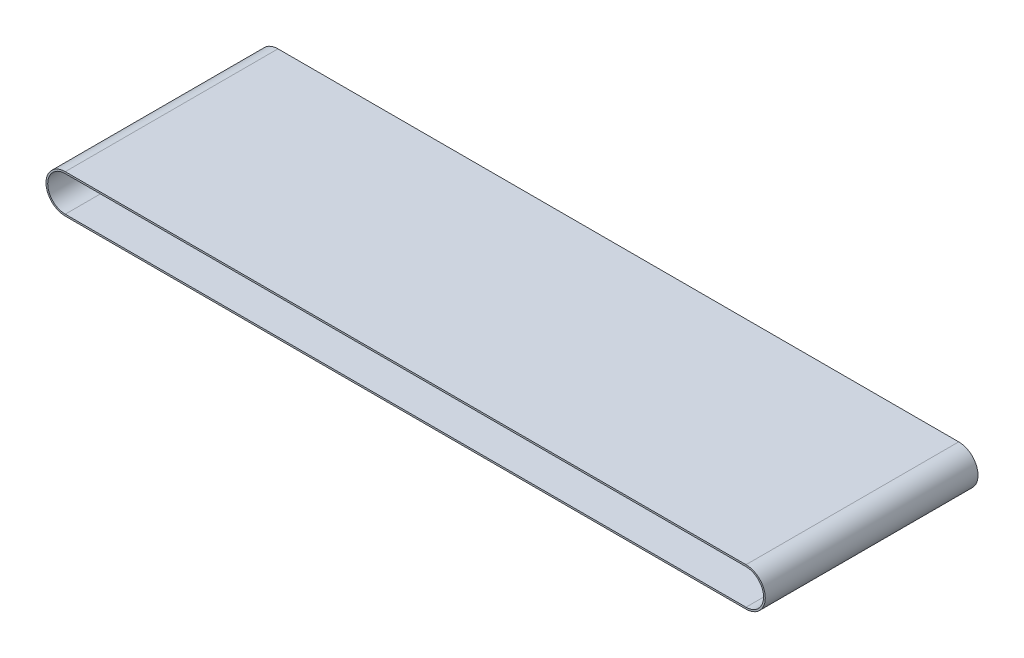
from build123d import *

# Parameters (mm, degrees)
BOSS_EXTRUDE1_DEPTH = 250


with BuildPart() as part:
    # Sketch1 → Boss-Extrude1 (new body)
    with BuildSketch(Plane.XY):
        with BuildLine():
            Line((0, 22.639636035), (800, 22.639636035))
            ThreePointArc((800, 22.639636035), (822.639636035, 0), (800, -22.639636035))
            Line((800, -22.639636035), (0, -22.639636035))
            ThreePointArc((0, -22.639636035), (-22.639636035, 0), (0, 22.639636035))
        make_face()
        with BuildLine():
            Line((0, 20.639636035), (800, 20.639636035))
            ThreePointArc((800, 20.639636035), (820.639636035, 0), (800, -20.639636035))
            Line((800, -20.639636035), (0, -20.639636035))
            ThreePointArc((0, -20.639636035), (-20.639636035, 0), (0, 20.639636035))
        make_face(mode=Mode.SUBTRACT)
    extrude(amount=BOSS_EXTRUDE1_DEPTH)


solid = part.part
